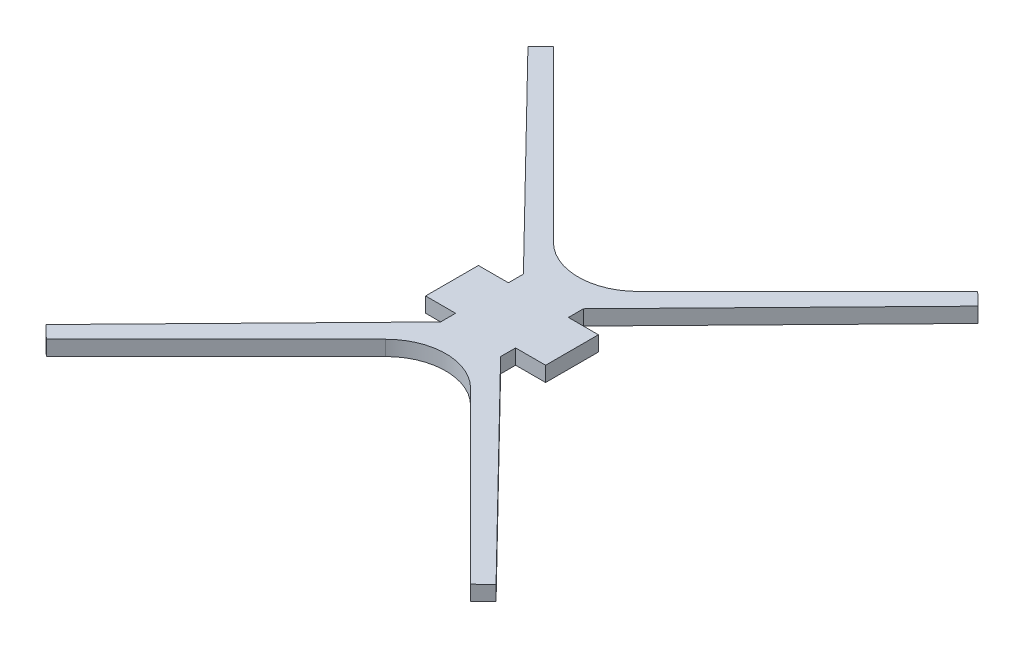
from build123d import *

# Parameters (mm, degrees)
SKETCH1_W           = 25.4
SKETCH1_H           = 11.176
BOSS_EXTRUDE1_DEPTH = 3.175


with BuildPart() as part:
    # Sketch1 → Boss-Extrude1 (new body)
    with BuildSketch(Plane(origin=(0, 0, 0), x_dir=(1, 0, 0), z_dir=(0, 1, 0))):
        with Locations((12.7, 5.588)):
            Rectangle(SKETCH1_W, SKETCH1_H)
        with BuildLine():
            Line((19.05, 11.176), (19.05, 14.351))
            Line((19.05, 14.351), (60.326216075, 56.589419985))
            Line((60.326216075, 56.589419985), (57.601280605, 59.252280605))
            Line((57.601280605, 59.252280605), (21.680256121, 23.331256121))
            ThreePointArc((21.680256121, 23.331256121), (12.7, 19.611512242), (3.719743879, 23.331256121))
            Line((3.719743879, 23.331256121), (-32.201280605, 59.252280605))
            Line((-32.201280605, 59.252280605), (-34.926216075, 56.589419985))
            Line((-34.926216075, 56.589419985), (6.35, 14.351))
            Line((6.35, 14.351), (6.35, 11.176))
            Line((6.35, 11.176), (19.05, 11.176))
        make_face()
        with BuildLine():
            Line((19.05, 0), (19.05, -3.175))
            Line((19.05, -3.175), (60.326216075, -45.413419985))
            Line((60.326216075, -45.413419985), (57.601280605, -48.076280605))
            Line((57.601280605, -48.076280605), (21.680256121, -12.155256121))
            ThreePointArc((21.680256121, -12.155256121), (12.7, -8.435512242), (3.719743879, -12.155256121))
            Line((3.719743879, -12.155256121), (-32.201280605, -48.076280605))
            Line((-32.201280605, -48.076280605), (-34.926216075, -45.413419985))
            Line((-34.926216075, -45.413419985), (6.35, -3.175))
            Line((6.35, -3.175), (6.35, 0))
            Line((6.35, 0), (19.05, 0))
        make_face()
    extrude(amount=BOSS_EXTRUDE1_DEPTH)


solid = part.part
